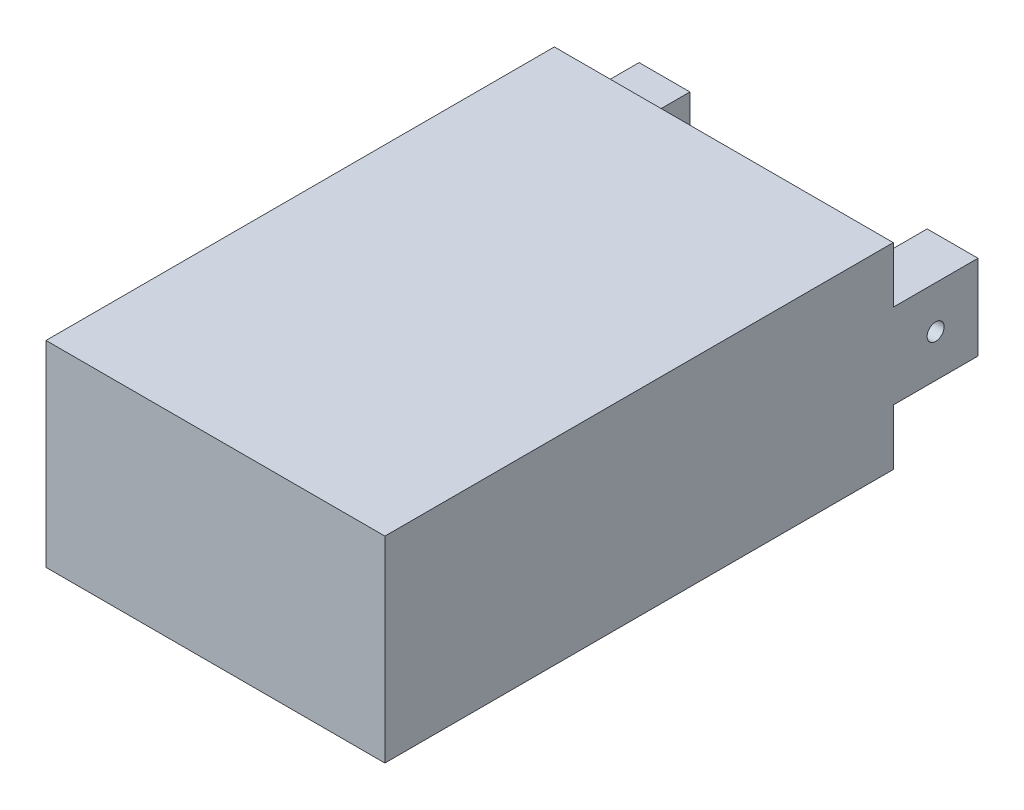
from build123d import *

# Parameters (mm, degrees)
SKETCH2_W           = 100
SKETCH2_H           = 58
BOSS_EXTRUDE1_DEPTH = 150
SKETCH3_W           = 15
SKETCH3_H           = 25
BOSS_EXTRUDE2_DEPTH = 25
CUT_EXTRUDE1_REACH  = 184.595
SKETCH4_R           = 2.5


with BuildPart() as part:
    # Sketch2 → Boss-Extrude1 (new body)
    with BuildSketch(Plane.XY):
        Rectangle(SKETCH2_W, SKETCH2_H)
    extrude(amount=BOSS_EXTRUDE1_DEPTH)

    # Sketch3 → Boss-Extrude2 (add)
    with BuildSketch(Plane(origin=(0, 0, 0), x_dir=(-1, 0, 0), z_dir=(0, 0, -1))):
        with Locations((42.5, 0)):
            Rectangle(SKETCH3_W, SKETCH3_H)
        with Locations((-42.5, 0)):
            Rectangle(SKETCH3_W, SKETCH3_H)
    extrude(amount=BOSS_EXTRUDE2_DEPTH)

    # Cut-Extrude1: up to this face of the body (flat: up to its plane)
    cut_extrude1_end = Plane(part.part.faces().sort_by_distance((50, 0, 69.13538874))[0])
    # Sketch4 → Cut-Extrude1 (cut, up to the picked face)
    with BuildSketch(Plane.ZY.offset(50), mode=Mode.PRIVATE) as cut_extrude1_sk1:
        with Locations((-12.5, 0)):
            Circle(SKETCH4_R)
    cut_extrude1_tool1 = split(extrude(cut_extrude1_sk1.sketch, amount=-CUT_EXTRUDE1_REACH, mode=Mode.PRIVATE), bisect_by=cut_extrude1_end, keep=Keep.BOTH, mode=Mode.PRIVATE)
    add(cut_extrude1_tool1.solids().sort_by(Axis((-50, 0, -12.5), (1, 0, 0)))[0], mode=Mode.SUBTRACT)


solid = part.part
